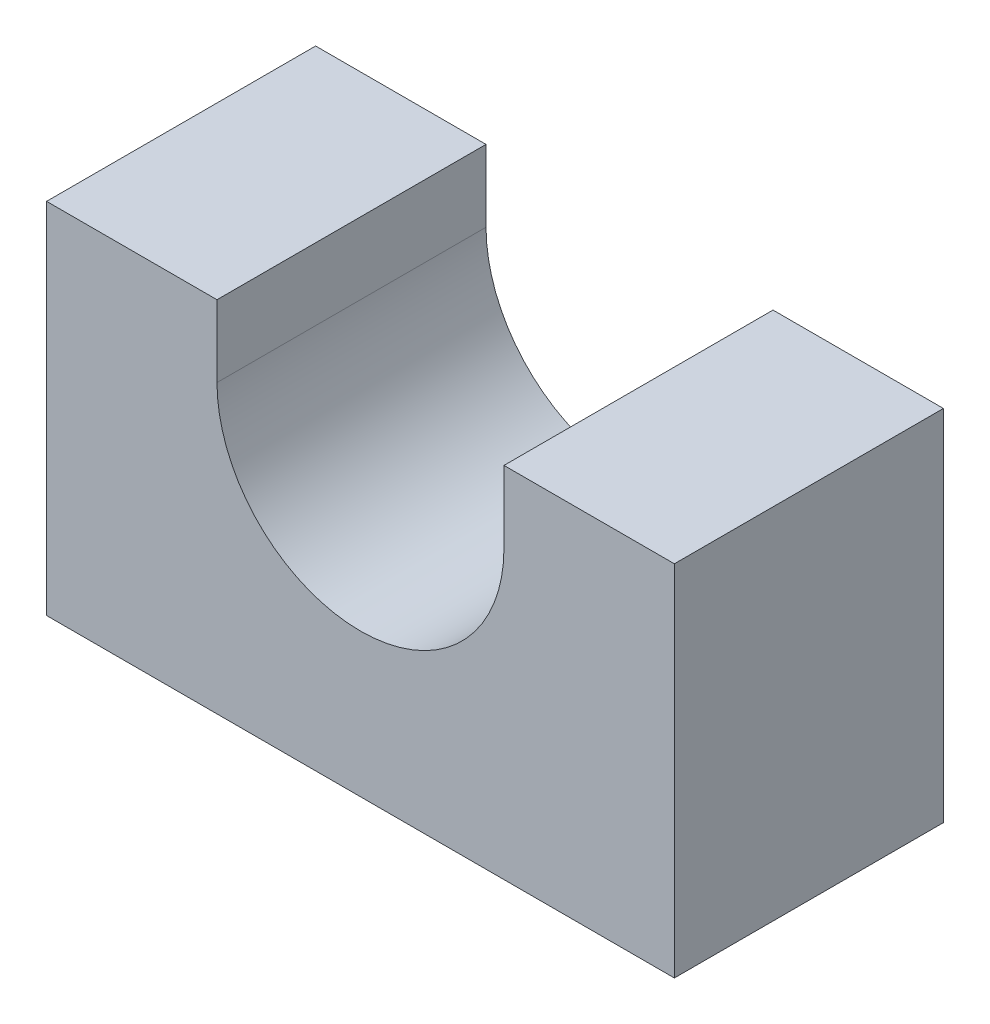
from build123d import *

# Parameters (mm, degrees)
BOSS_EXTRUDE1_DEPTH = 150


with BuildPart() as part:
    # Sketch3 → Boss-Extrude1 (new body)
    with BuildSketch(Plane.XY):
        with BuildLine():
            Line((-175, 0), (175, 0))
            Line((175, 0), (175, 200))
            Line((175, 200), (80, 200))
            Line((80, 200), (80, 160))
            ThreePointArc((80, 160), (0, 80), (-80, 160))
            Line((-80, 160), (-80, 200))
            Line((-80, 200), (-175, 200))
            Line((-175, 200), (-175, 0))
        make_face()
    extrude(amount=BOSS_EXTRUDE1_DEPTH)


solid = part.part
